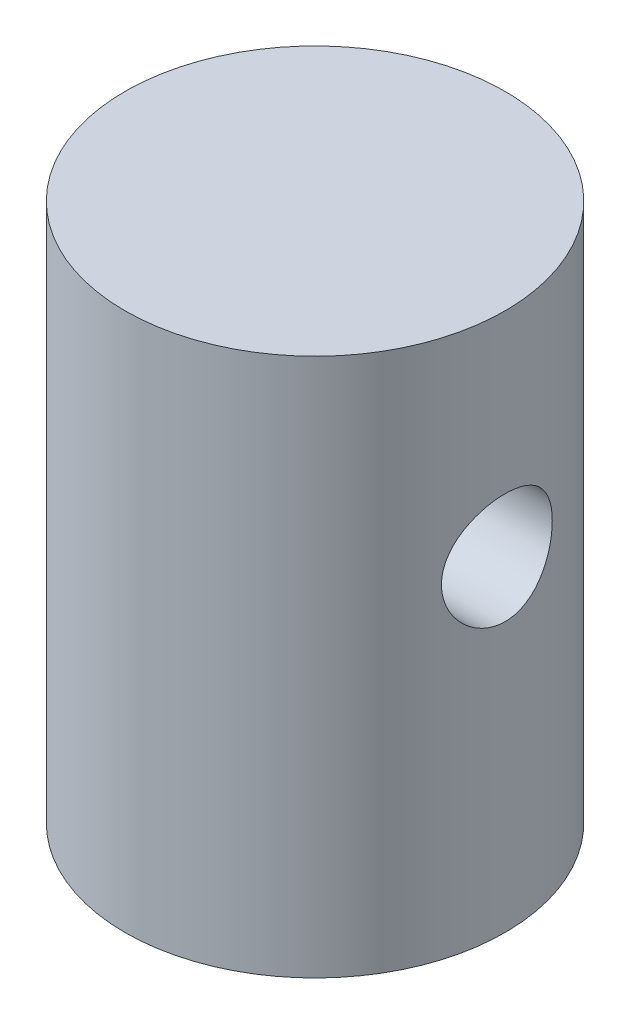
from build123d import *

# Parameters (mm, degrees)
SKETCH1_R               = 6
BOSS_EXTRUDE1_DEPTH     = 17
CUT_EXTRUDE1_DEPTH      = 17
CUT_EXTRUDE1_DEPTH_BACK = 17
SKETCH2_R               = 1.75


with BuildPart() as part:
    # Sketch1 → Boss-Extrude1 (new body)
    with BuildSketch(Plane(origin=(0, 0, 0), x_dir=(1, 0, 0), z_dir=(0, 1, 0))):
        Circle(SKETCH1_R)
    extrude(amount=BOSS_EXTRUDE1_DEPTH)

    # Sketch2 → Cut-Extrude1 (cut, two sides: drawn at the far end of the back side and taken through both)
    with BuildSketch(Plane(origin=(0, 0, 0), x_dir=(0, 0, -1), z_dir=(1, 0, 0)).offset(-CUT_EXTRUDE1_DEPTH_BACK)):
        with Locations((0, 10.25)):
            Circle(SKETCH2_R)
    extrude(amount=CUT_EXTRUDE1_DEPTH + CUT_EXTRUDE1_DEPTH_BACK, mode=Mode.SUBTRACT)


solid = part.part
